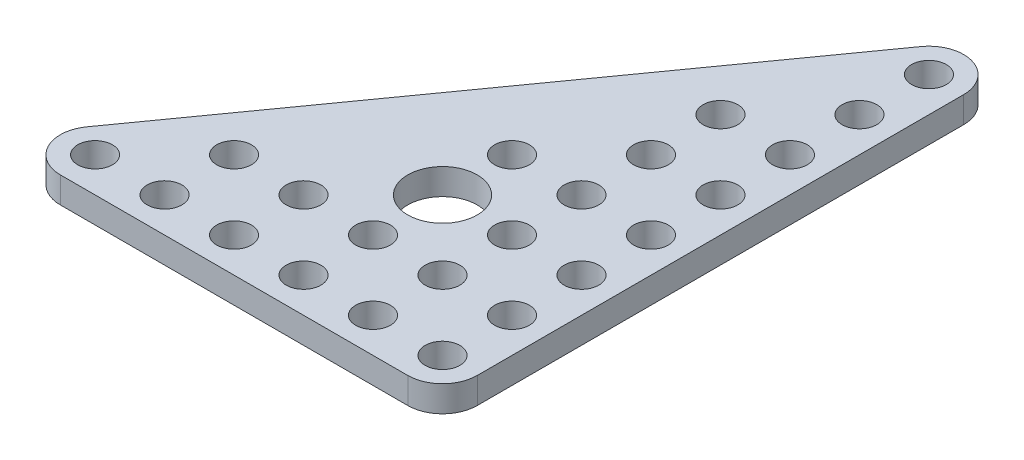
from build123d import *

# Parameters (mm, degrees)
BOSS_EXTRUDE2_DEPTH = 3
SKETCH4_R           = 2
SKETCH4_R_2         = 4
CUT_EXTRUDE3_DEPTH  = 7


with BuildPart() as part:
    # Sketch2 → Boss-Extrude2 (new body)
    with BuildSketch(Plane(origin=(0, 0, 0), x_dir=(1, 0, 0), z_dir=(0, 1, 0))):
        with BuildLine():
            Line((17.180375272, -22.928844638), (17.180375272, 33.071155362))
            ThreePointArc((17.180375272, 33.071155362), (14.401084996, 36.880337397), (9.925441387, 35.396108137))
            Line((9.925441387, 35.396108137), (-30.074558613, -20.603891863))
            ThreePointArc((-30.074558613, -20.603891863), (-30.376295299, -24.759170961), (-26.819624728, -26.928844638))
            Line((-26.819624728, -26.928844638), (13.180375272, -26.928844638))
            ThreePointArc((13.180375272, -26.928844638), (16.008802397, -25.757271762), (17.180375272, -22.928844638))
        make_face()
    extrude(amount=BOSS_EXTRUDE2_DEPTH)

    # Sketch4 → Cut-Extrude3 (cut)
    with BuildSketch(Plane(origin=(0, 0, 0), x_dir=(1, 0, 0), z_dir=(0, 1, 0))):
        with Locations(Location((13.180375272, -22.928844638, 0), (0, 0, 270))):
            Circle(SKETCH4_R)
        with Locations(Location((13.180375272, -14.928844638, 0), (0, 0, 270))):
            Circle(SKETCH4_R)
        with Locations(Location((13.180375272, -6.928844638, 0), (0, 0, 270))):
            Circle(SKETCH4_R)
        with Locations(Location((13.180375272, 1.071155362, 0), (0, 0, 270))):
            Circle(SKETCH4_R)
        with Locations(Location((13.180375272, 9.071155362, 0), (0, 0, 270))):
            Circle(SKETCH4_R)
        with Locations(Location((13.180375272, 17.071155362, 0), (0, 0, 270))):
            Circle(SKETCH4_R)
        with Locations(Location((13.180375272, 25.071155362, 0), (0, 0, 270))):
            Circle(SKETCH4_R)
        with Locations(Location((13.180375272, 33.071155362, 0), (0, 0, 270))):
            Circle(SKETCH4_R)
        with Locations(Location((5.180375272, -22.928844638, 0), (0, 0, 270))):
            Circle(SKETCH4_R)
        with Locations(Location((-2.819624728, -22.928844638, 0), (0, 0, 270))):
            Circle(SKETCH4_R)
        with Locations(Location((-10.819624728, -22.928844638, 0), (0, 0, 270))):
            Circle(SKETCH4_R)
        with Locations(Location((-18.819624728, -22.928844638, 0), (0, 0, 270))):
            Circle(SKETCH4_R)
        with Locations(Location((-26.819624728, -22.928844638, 0), (0, 0, 270))):
            Circle(SKETCH4_R)
        with Locations(Location((-18.819624728, -14.928844638, 0), (0, 0, 270))):
            Circle(SKETCH4_R)
        with Locations(Location((-10.819624728, -14.928844638, 0), (0, 0, 270))):
            Circle(SKETCH4_R)
        with Locations(Location((-2.819624728, -14.928844638, 0), (0, 0, 270))):
            Circle(SKETCH4_R)
        with Locations(Location((5.180375272, -14.928844638, 0), (0, 0, 270))):
            Circle(SKETCH4_R)
        with Locations(Location((5.180375272, -6.928844638, 0), (0, 0, 270))):
            Circle(SKETCH4_R)
        with Locations(Location((5.180375272, 1.071155362, 0), (0, 0, 270))):
            Circle(SKETCH4_R)
        with Locations(Location((5.180375272, 9.071155362, 0), (0, 0, 270))):
            Circle(SKETCH4_R)
        with Locations(Location((5.180375272, 17.071155362, 0), (0, 0, 270))):
            Circle(SKETCH4_R)
        with Locations(Location((-2.819624728, 1.071155362, 0), (0, 0, 270))):
            Circle(SKETCH4_R)
        with Locations(Location((-2.819624728, -6.928844638, 0), (0, 0, 270))):
            Circle(SKETCH4_R_2)
    extrude(amount=CUT_EXTRUDE3_DEPTH, mode=Mode.SUBTRACT)


solid = part.part
